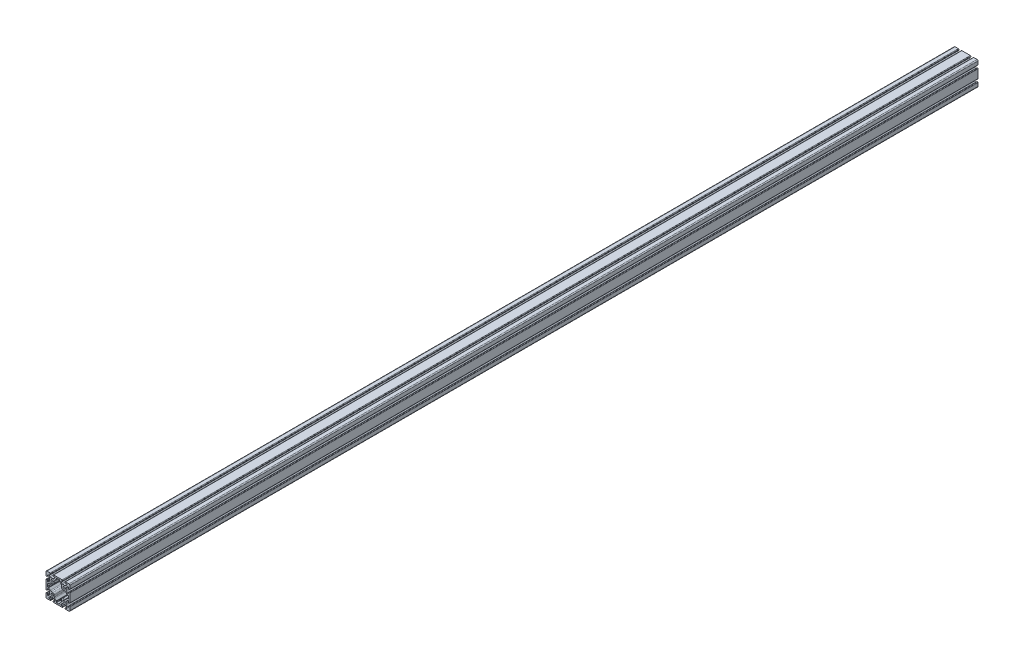
from build123d import *

# Parameters (mm, degrees)
SKETCH1_R      = 3.4
EXTRUDE1_DEPTH = 3048


with BuildPart() as part:
    # Sketch1 → Extrude1 (new body)
    with BuildSketch(Plane.XY):
        with BuildLine():
            Line((29.091242789, 26.036541495), (33.082657296, 30.027956002))
            ThreePointArc((33.082657296, 30.027956002), (33.329219041, 30.192703293), (33.62005845, 30.250554848))
            Line((33.62005845, 30.250554848), (33.955571436, 30.250554848))
            ThreePointArc((33.955571436, 30.250554848), (35.065729082, 29.790712494), (35.525571436, 28.680554848))
            Line((35.525571436, 28.680554848), (35.525571436, 25.777866899))
            ThreePointArc((35.525571436, 25.777866899), (35.985413789, 24.667709253), (37.095571436, 24.207866899))
            Line((37.095571436, 24.207866899), (38.43, 24.207866899))
            ThreePointArc((38.43, 24.207866899), (39.540157646, 24.667709253), (40, 25.777866899))
            Line((40, 25.777866899), (40, 32.933852749))
            Line((40, 32.933852749), (40, 36.83))
            ThreePointArc((40, 36.83), (39.071528496, 39.071528496), (36.83, 40))
            Line((36.83, 40), (25.540851266, 40))
            ThreePointArc((25.540851266, 40), (24.43069362, 39.540157646), (23.970851266, 38.43))
            Line((23.970851266, 38.43), (23.970851266, 37.249043598))
            ThreePointArc((23.970851266, 37.249043598), (24.43069362, 36.138885952), (25.540851266, 35.679043598))
            Line((25.540851266, 35.679043598), (28.625762638, 35.679043598))
            ThreePointArc((28.625762638, 35.679043598), (29.77116849, 35.239363487), (30.250554848, 34.11))
            Line((30.250554848, 34.11), (30.250554848, 33.62005845))
            ThreePointArc((30.250554848, 33.62005845), (30.192703293, 33.329219041), (30.027956002, 33.082657296))
            Line((30.027956002, 33.082657296), (26.036541495, 29.091242789))
            ThreePointArc((26.036541495, 29.091242789), (24.495530588, 28.061572221), (22.677784284, 27.7))
            Line((22.677784284, 27.7), (17.322215716, 27.7))
            ThreePointArc((17.322215716, 27.7), (15.504469412, 28.061572221), (13.963458505, 29.091242789))
            Line((13.963458505, 29.091242789), (9.90393336, 33.150767934))
            ThreePointArc((9.90393336, 33.150767934), (9.764102181, 33.360040084), (9.715, 33.606893415))
            Line((9.715, 33.606893415), (9.715, 34.096834965))
            ThreePointArc((9.715, 34.096834965), (10.178698303, 35.216301697), (11.298165035, 35.68))
            Line((11.298165035, 35.68), (14.642754087, 35.68))
            ThreePointArc((14.642754087, 35.68), (15.560045469, 36.059954531), (15.94, 36.977245913))
            Line((15.94, 36.977245913), (15.94, 38.194841282))
            ThreePointArc((15.94, 38.194841282), (15.411281253, 39.471281253), (14.134841282, 40))
            Line((14.134841282, 40), (6.984433948, 40))
            Line((6.984433948, 40), (-6.984433948, 40))
            Line((-6.984433948, 40), (-14.134841282, 40))
            ThreePointArc((-14.134841282, 40), (-15.411281253, 39.471281253), (-15.94, 38.194841282))
            Line((-15.94, 38.194841282), (-15.94, 36.977245913))
            ThreePointArc((-15.94, 36.977245913), (-15.560045469, 36.059954531), (-14.642754087, 35.68))
            Line((-14.642754087, 35.68), (-11.298165035, 35.68))
            ThreePointArc((-11.298165035, 35.68), (-10.178698303, 35.216301697), (-9.715, 34.096834965))
            Line((-9.715, 34.096834965), (-9.715, 33.606893415))
            ThreePointArc((-9.715, 33.606893415), (-9.764102181, 33.360040084), (-9.90393336, 33.150767934))
            Line((-9.90393336, 33.150767934), (-13.963458505, 29.091242789))
            ThreePointArc((-13.963458505, 29.091242789), (-15.504469412, 28.061572221), (-17.322215716, 27.7))
            Line((-17.322215716, 27.7), (-22.677784284, 27.7))
            ThreePointArc((-22.677784284, 27.7), (-24.495530588, 28.061572221), (-26.036541495, 29.091242789))
            Line((-26.036541495, 29.091242789), (-30.09606664, 33.150767934))
            ThreePointArc((-30.09606664, 33.150767934), (-30.235897819, 33.360040084), (-30.285, 33.606893415))
            Line((-30.285, 33.606893415), (-30.285, 34.096834965))
            ThreePointArc((-30.285, 34.096834965), (-29.821301697, 35.216301697), (-28.701834965, 35.68))
            Line((-28.701834965, 35.68), (-25.357245913, 35.68))
            ThreePointArc((-25.357245913, 35.68), (-24.439954531, 36.059954531), (-24.06, 36.977245913))
            Line((-24.06, 36.977245913), (-24.06, 38.194841282))
            ThreePointArc((-24.06, 38.194841282), (-24.588718747, 39.471281253), (-25.865158718, 40))
            Line((-25.865158718, 40), (-33.031395847, 40))
            Line((-33.031395847, 40), (-36.83, 40))
            ThreePointArc((-36.83, 40), (-39.071528496, 39.071528496), (-40, 36.83))
            Line((-40, 36.83), (-40, 33.318079463))
            Line((-40, 33.318079463), (-40, 25.865158718))
            ThreePointArc((-40, 25.865158718), (-39.471281253, 24.588718747), (-38.194841282, 24.06))
            Line((-38.194841282, 24.06), (-36.977245913, 24.06))
            ThreePointArc((-36.977245913, 24.06), (-36.059954531, 24.439954531), (-35.68, 25.357245913))
            Line((-35.68, 25.357245913), (-35.68, 28.680554848))
            ThreePointArc((-35.68, 28.680554848), (-35.220157646, 29.790712494), (-34.11, 30.250554848))
            Line((-34.11, 30.250554848), (-33.62005845, 30.250554848))
            ThreePointArc((-33.62005845, 30.250554848), (-33.329219041, 30.192703293), (-33.082657296, 30.027956002))
            Line((-33.082657296, 30.027956002), (-29.091242789, 26.036541495))
            ThreePointArc((-29.091242789, 26.036541495), (-28.061572221, 24.495530588), (-27.7, 22.677784284))
            Line((-27.7, 22.677784284), (-27.7, 17.322215716))
            ThreePointArc((-27.7, 17.322215716), (-28.061572221, 15.504469412), (-29.091242789, 13.963458505))
            Line((-29.091242789, 13.963458505), (-33.082657296, 9.972043998))
            ThreePointArc((-33.082657296, 9.972043998), (-33.329219041, 9.807296707), (-33.62005845, 9.749445152))
            Line((-33.62005845, 9.749445152), (-34.11, 9.749445152))
            ThreePointArc((-34.11, 9.749445152), (-35.220157646, 10.209287506), (-35.68, 11.319445152))
            Line((-35.68, 11.319445152), (-35.68, 14.642754087))
            ThreePointArc((-35.68, 14.642754087), (-36.059954531, 15.560045469), (-36.977245913, 15.94))
            Line((-36.977245913, 15.94), (-38.194841282, 15.94))
            ThreePointArc((-38.194841282, 15.94), (-39.471281253, 15.411281253), (-40, 14.134841282))
            Line((-40, 14.134841282), (-40, 7.016888977))
            Line((-40, 7.016888977), (-40, -7.016888977))
            Line((-40, -7.016888977), (-40, -14.447338303))
            ThreePointArc((-40, -14.447338303), (-39.540157646, -15.557495949), (-38.43, -16.017338303))
            Line((-38.43, -16.017338303), (-37.25, -16.017338303))
            ThreePointArc((-37.25, -16.017338303), (-36.139842354, -15.557495949), (-35.68, -14.447338303))
            Line((-35.68, -14.447338303), (-35.68, -11.319445152))
            ThreePointArc((-35.68, -11.319445152), (-35.220157646, -10.209287506), (-34.11, -9.749445152))
            Line((-34.11, -9.749445152), (-33.62005845, -9.749445152))
            ThreePointArc((-33.62005845, -9.749445152), (-33.329219041, -9.807296707), (-33.082657296, -9.972043998))
            Line((-33.082657296, -9.972043998), (-29.091242789, -13.963458505))
            ThreePointArc((-29.091242789, -13.963458505), (-28.061572221, -15.504469412), (-27.7, -17.322215716))
            Line((-27.7, -17.322215716), (-27.7, -22.677784284))
            ThreePointArc((-27.7, -22.677784284), (-28.061572221, -24.495530588), (-29.091242789, -26.036541495))
            Line((-29.091242789, -26.036541495), (-32.871776968, -29.817075674))
            ThreePointArc((-32.871776968, -29.817075674), (-33.10612883, -29.976640176), (-33.382654504, -30.039211548))
            Line((-33.382654504, -30.039211548), (-34.05520779, -30.062697627))
            ThreePointArc((-34.05520779, -30.062697627), (-35.200613642, -29.623017515), (-35.68, -28.493654028))
            Line((-35.68, -28.493654028), (-35.68, -25.59096608))
            ThreePointArc((-35.68, -25.59096608), (-36.139842354, -24.480808433), (-37.25, -24.02096608))
            Line((-37.25, -24.02096608), (-38.43, -24.02096608))
            ThreePointArc((-38.43, -24.02096608), (-39.540157646, -24.480808433), (-40, -25.59096608))
            Line((-40, -25.59096608), (-40, -33.019082273))
            Line((-40, -33.019082273), (-40, -36.83))
            ThreePointArc((-40, -36.83), (-39.071528496, -39.071528496), (-36.83, -40))
            Line((-36.83, -40), (-33, -40))
            Line((-33, -40), (-25.72307469, -40))
            ThreePointArc((-25.72307469, -40), (-24.612917043, -39.540157646), (-24.15307469, -38.43))
            Line((-24.15307469, -38.43), (-24.15307469, -37.25))
            ThreePointArc((-24.15307469, -37.25), (-24.612917043, -36.139842354), (-25.72307469, -35.68))
            Line((-25.72307469, -35.68), (-28.680554848, -35.68))
            ThreePointArc((-28.680554848, -35.68), (-29.790712494, -35.220157646), (-30.250554848, -34.11))
            Line((-30.250554848, -34.11), (-30.250554848, -33.62005845))
            ThreePointArc((-30.250554848, -33.62005845), (-30.192703293, -33.329219041), (-30.027956002, -33.082657296))
            Line((-30.027956002, -33.082657296), (-26.036541495, -29.091242789))
            ThreePointArc((-26.036541495, -29.091242789), (-24.495530588, -28.061572221), (-22.677784284, -27.7))
            Line((-22.677784284, -27.7), (-17.322215716, -27.7))
            ThreePointArc((-17.322215716, -27.7), (-15.504469412, -28.061572221), (-13.963458505, -29.091242789))
            Line((-13.963458505, -29.091242789), (-10.203784275, -32.85091702))
            ThreePointArc((-10.203784275, -32.85091702), (-10.044219772, -33.085268882), (-9.9816484, -33.361794556))
            Line((-9.9816484, -33.361794556), (-9.957433876, -34.05520779))
            ThreePointArc((-9.957433876, -34.05520779), (-10.397113988, -35.200613642), (-11.526477474, -35.68))
            Line((-11.526477474, -35.68), (-14.429165423, -35.68))
            ThreePointArc((-14.429165423, -35.68), (-15.539323069, -36.139842354), (-15.999165423, -37.25))
            Line((-15.999165423, -37.25), (-15.999165423, -38.43))
            ThreePointArc((-15.999165423, -38.43), (-15.539323069, -39.540157646), (-14.429165423, -40))
            Line((-14.429165423, -40), (-6.998716097, -40))
            Line((-6.998716097, -40), (6.998716097, -40))
            Line((6.998716097, -40), (14.424638994, -40))
            ThreePointArc((14.424638994, -40), (15.53479664, -39.540157646), (15.994638994, -38.43))
            Line((15.994638994, -38.43), (15.994638994, -37.032644306))
            ThreePointArc((15.994638994, -37.032644306), (15.53479664, -35.922486659), (14.424638994, -35.462644306))
            Line((14.424638994, -35.462644306), (11.382372282, -35.462644306))
            ThreePointArc((11.382372282, -35.462644306), (10.272214636, -35.002801952), (9.812372282, -33.892644306))
            Line((9.812372282, -33.892644306), (9.812372282, -33.55713132))
            ThreePointArc((9.812372282, -33.55713132), (9.870223837, -33.266291912), (10.034971128, -33.019730166))
            Line((10.034971128, -33.019730166), (13.963458505, -29.091242789))
            ThreePointArc((13.963458505, -29.091242789), (15.504469412, -28.061572221), (17.322215716, -27.7))
            Line((17.322215716, -27.7), (22.677784284, -27.7))
            ThreePointArc((22.677784284, -27.7), (24.495530588, -28.061572221), (26.036541495, -29.091242789))
            Line((26.036541495, -29.091242789), (29.794925243, -32.849626538))
            ThreePointArc((29.794925243, -32.849626538), (29.954489746, -33.083978399), (30.017061118, -33.360504074))
            Line((30.017061118, -33.360504074), (30.041320706, -34.05520779))
            ThreePointArc((30.041320706, -34.05520779), (29.601640594, -35.200613642), (28.472277108, -35.68))
            Line((28.472277108, -35.68), (25.569589159, -35.68))
            ThreePointArc((25.569589159, -35.68), (24.459431513, -36.139842354), (23.999589159, -37.25))
            Line((23.999589159, -37.25), (23.999589159, -38.43))
            ThreePointArc((23.999589159, -38.43), (24.459431513, -39.540157646), (25.569589159, -40))
            Line((25.569589159, -40), (32.999849358, -40))
            Line((32.999849358, -40), (36.83, -40))
            ThreePointArc((36.83, -40), (39.071528496, -39.071528496), (40, -36.83))
            Line((40, -36.83), (40, -33.025941835))
            Line((40, -33.025941835), (40, -25.777866899))
            ThreePointArc((40, -25.777866899), (39.540157646, -24.667709253), (38.43, -24.207866899))
            Line((38.43, -24.207866899), (37.25, -24.207866899))
            ThreePointArc((37.25, -24.207866899), (36.139842354, -24.667709253), (35.68, -25.777866899))
            Line((35.68, -25.777866899), (35.68, -28.680554848))
            ThreePointArc((35.68, -28.680554848), (35.220157646, -29.790712494), (34.11, -30.250554848))
            Line((34.11, -30.250554848), (33.62005845, -30.250554848))
            ThreePointArc((33.62005845, -30.250554848), (33.329219041, -30.192703293), (33.082657296, -30.027956002))
            Line((33.082657296, -30.027956002), (29.091242789, -26.036541495))
            ThreePointArc((29.091242789, -26.036541495), (28.061572221, -24.495530588), (27.7, -22.677784284))
            Line((27.7, -22.677784284), (27.7, -17.322215716))
            ThreePointArc((27.7, -17.322215716), (28.061572221, -15.504469412), (29.091242789, -13.963458505))
            Line((29.091242789, -13.963458505), (33.082657296, -9.972043998))
            ThreePointArc((33.082657296, -9.972043998), (33.329219041, -9.807296707), (33.62005845, -9.749445152))
            Line((33.62005845, -9.749445152), (34.11, -9.749445152))
            ThreePointArc((34.11, -9.749445152), (35.220157646, -10.209287506), (35.68, -11.319445152))
            Line((35.68, -11.319445152), (35.68, -14.222133101))
            ThreePointArc((35.68, -14.222133101), (36.139842354, -15.332290747), (37.25, -15.792133101))
            Line((37.25, -15.792133101), (38.43, -15.792133101))
            ThreePointArc((38.43, -15.792133101), (39.540157646, -15.332290747), (40, -14.222133101))
            Line((40, -14.222133101), (40, -7.021415406))
            Line((40, -7.021415406), (40, 7.021415406))
            Line((40, 7.021415406), (40, 14.222133101))
            ThreePointArc((40, 14.222133101), (39.540157646, 15.332290747), (38.43, 15.792133101))
            Line((38.43, 15.792133101), (37.25, 15.792133101))
            ThreePointArc((37.25, 15.792133101), (36.139842354, 15.332290747), (35.68, 14.222133101))
            Line((35.68, 14.222133101), (35.68, 11.319445152))
            ThreePointArc((35.68, 11.319445152), (35.220157646, 10.209287506), (34.11, 9.749445152))
            Line((34.11, 9.749445152), (33.62005845, 9.749445152))
            ThreePointArc((33.62005845, 9.749445152), (33.329219041, 9.807296707), (33.082657296, 9.972043998))
            Line((33.082657296, 9.972043998), (29.091242789, 13.963458505))
            ThreePointArc((29.091242789, 13.963458505), (28.061572221, 15.504469412), (27.7, 17.322215716))
            Line((27.7, 17.322215716), (27.7, 22.677784284))
            ThreePointArc((27.7, 22.677784284), (28.061572221, 24.495530588), (29.091242789, 26.036541495))
        make_face()
        with Locations((-20, 20)):
            Circle(SKETCH1_R, mode=Mode.SUBTRACT)
        with Locations((20, 20)):
            Circle(SKETCH1_R, mode=Mode.SUBTRACT)
        with Locations((20, -20)):
            Circle(SKETCH1_R, mode=Mode.SUBTRACT)
        with Locations((-20, -20)):
            Circle(SKETCH1_R, mode=Mode.SUBTRACT)
        with BuildLine():
            Line((17.07, 12.32), (22.657784284, 12.32))
            ThreePointArc((22.657784284, 12.32), (24.475530588, 11.958427779), (26.016541495, 10.928757211))
            Line((26.016541495, 10.928757211), (31.143879165, 5.80141954))
            ThreePointArc((31.143879165, 5.80141954), (31.555896818, 5.526118146), (32.041904777, 5.429445152))
            Line((32.041904777, 5.429445152), (34.41, 5.429445152))
            ThreePointArc((34.41, 5.429445152), (35.308025612, 5.057470764), (35.68, 4.159445152))
            Line((35.68, 4.159445152), (35.68, -4.159445152))
            ThreePointArc((35.68, -4.159445152), (35.308025612, -5.057470764), (34.41, -5.429445152))
            Line((34.41, -5.429445152), (32.041904777, -5.429445152))
            ThreePointArc((32.041904777, -5.429445152), (31.555896818, -5.526118146), (31.143879165, -5.80141954))
            Line((31.143879165, -5.80141954), (26.016541495, -10.928757211))
            ThreePointArc((26.016541495, -10.928757211), (24.475530588, -11.958427779), (22.657784284, -12.32))
            Line((22.657784284, -12.32), (17.07, -12.32))
            ThreePointArc((17.07, -12.32), (13.711242789, -13.711242789), (12.32, -17.07))
            Line((12.32, -17.07), (12.32, -22.657784284))
            ThreePointArc((12.32, -22.657784284), (11.958427779, -24.475530588), (10.928757211, -26.016541495))
            Line((10.928757211, -26.016541495), (5.80141954, -31.143879165))
            ThreePointArc((5.80141954, -31.143879165), (5.526118146, -31.555896818), (5.429445152, -32.041904777))
            Line((5.429445152, -32.041904777), (5.429445152, -34.41))
            ThreePointArc((5.429445152, -34.41), (5.057470764, -35.308025612), (4.159445152, -35.68))
            Line((4.159445152, -35.68), (-4.159445152, -35.68))
            ThreePointArc((-4.159445152, -35.68), (-5.057470764, -35.308025612), (-5.429445152, -34.41))
            Line((-5.429445152, -34.41), (-5.429445152, -32.041904777))
            ThreePointArc((-5.429445152, -32.041904777), (-5.526118146, -31.555896818), (-5.80141954, -31.143879165))
            Line((-5.80141954, -31.143879165), (-10.928757211, -26.016541495))
            ThreePointArc((-10.928757211, -26.016541495), (-11.958427779, -24.475530588), (-12.32, -22.657784284))
            Line((-12.32, -22.657784284), (-12.32, -17.07))
            ThreePointArc((-12.32, -17.07), (-13.711242789, -13.711242789), (-17.07, -12.32))
            Line((-17.07, -12.32), (-22.657784284, -12.32))
            ThreePointArc((-22.657784284, -12.32), (-24.475530588, -11.958427779), (-26.016541495, -10.928757211))
            Line((-26.016541495, -10.928757211), (-31.143879165, -5.80141954))
            ThreePointArc((-31.143879165, -5.80141954), (-31.555896818, -5.526118146), (-32.041904777, -5.429445152))
            Line((-32.041904777, -5.429445152), (-34.41, -5.429445152))
            ThreePointArc((-34.41, -5.429445152), (-35.308025612, -5.057470764), (-35.68, -4.159445152))
            Line((-35.68, -4.159445152), (-35.68, 4.159445152))
            ThreePointArc((-35.68, 4.159445152), (-35.308025612, 5.057470764), (-34.41, 5.429445152))
            Line((-34.41, 5.429445152), (-32.041904777, 5.429445152))
            ThreePointArc((-32.041904777, 5.429445152), (-31.555896818, 5.526118146), (-31.143879165, 5.80141954))
            Line((-31.143879165, 5.80141954), (-26.016541495, 10.928757211))
            ThreePointArc((-26.016541495, 10.928757211), (-24.475530588, 11.958427779), (-22.657784284, 12.32))
            Line((-22.657784284, 12.32), (-17.07, 12.32))
            ThreePointArc((-17.07, 12.32), (-13.711242789, 13.711242789), (-12.32, 17.07))
            Line((-12.32, 17.07), (-12.32, 22.657784284))
            ThreePointArc((-12.32, 22.657784284), (-11.958427779, 24.475530588), (-10.928757211, 26.016541495))
            Line((-10.928757211, 26.016541495), (-5.80141954, 31.143879165))
            ThreePointArc((-5.80141954, 31.143879165), (-5.526118146, 31.555896818), (-5.429445152, 32.041904777))
            Line((-5.429445152, 32.041904777), (-5.429445152, 34.41))
            ThreePointArc((-5.429445152, 34.41), (-5.057470764, 35.308025612), (-4.159445152, 35.68))
            Line((-4.159445152, 35.68), (4.159445152, 35.68))
            ThreePointArc((4.159445152, 35.68), (5.057470764, 35.308025612), (5.429445152, 34.41))
            Line((5.429445152, 34.41), (5.429445152, 32.041904777))
            ThreePointArc((5.429445152, 32.041904777), (5.526118146, 31.555896818), (5.80141954, 31.143879165))
            Line((5.80141954, 31.143879165), (10.928757211, 26.016541495))
            ThreePointArc((10.928757211, 26.016541495), (11.958427779, 24.475530588), (12.32, 22.657784284))
            Line((12.32, 22.657784284), (12.32, 17.07))
            ThreePointArc((12.32, 17.07), (13.711242789, 13.711242789), (17.07, 12.32))
        make_face(mode=Mode.SUBTRACT)
    extrude(amount=-EXTRUDE1_DEPTH)


solid = part.part
